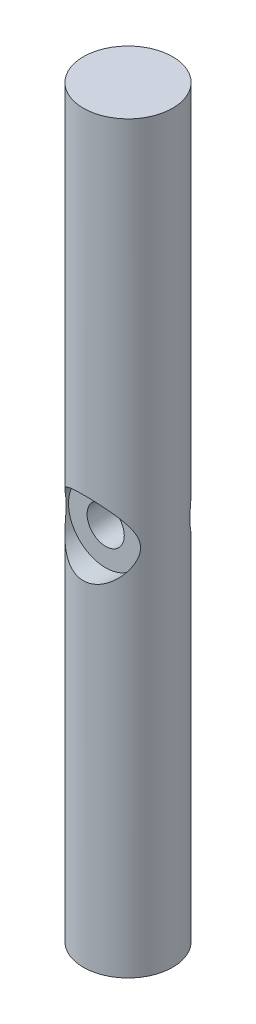
from build123d import *

# Parameters (mm, degrees)
SKETCH1_W           = 12
SKETCH1_H           = 12
BOSS_EXTRUDE1_DEPTH = 100
CUT_EXTRUDE1_REACH  = 103.43
SKETCH5_R           = 2.5
SKETCH6_R           = 5
CUT_EXTRUDE3_DEPTH  = 3
CUT_EXTRUDE4_START  = -3
SKETCH7_R           = 5
SKETCH7_R_2         = 2.5
CUT_EXTRUDE4_DEPTH  = 3
CUT_EXTRUDE5_DEPTH  = 100


with BuildPart() as part:
    # Sketch1 → Boss-Extrude1 (new body)
    with BuildSketch(Plane(origin=(0, 0, 0), x_dir=(1, 0, 0), z_dir=(0, 1, 0))):
        with Locations((6, -6)):
            Rectangle(SKETCH1_W, SKETCH1_H)
    extrude(amount=BOSS_EXTRUDE1_DEPTH)

    # Sketch5 → Cut-Extrude1 (cut, up to next)
    with BuildSketch(Plane.XY.offset(12), mode=Mode.PRIVATE) as cut_extrude1_sk1:
        with Locations((6, 50)):
            Circle(SKETCH5_R)
    cut_extrude1_tool1 = extrude(cut_extrude1_sk1.sketch, amount=-CUT_EXTRUDE1_REACH, mode=Mode.PRIVATE) & part.part
    add(cut_extrude1_tool1.solids().sort_by_distance((6, 50, 12))[0], mode=Mode.SUBTRACT)

    # Sketch6 → Cut-Extrude3 (cut)
    with BuildSketch(Plane.XY.offset(12)):
        with Locations((6, 50)):
            Circle(SKETCH6_R)
    extrude(amount=-CUT_EXTRUDE3_DEPTH, mode=Mode.SUBTRACT)

    # Sketch7 → Cut-Extrude4 (cut)
    with BuildSketch(Plane(origin=(0, 0, 0), x_dir=(-1, 0, 0), z_dir=(0, 0, -1)).offset(CUT_EXTRUDE4_START)):
        with Locations(Location((-6, 50, 0), (0, 0, 180))):
            Circle(SKETCH7_R)
        with Locations(Location((-6, 50, 0), (0, 0, 180))):
            Circle(SKETCH7_R_2, mode=Mode.SUBTRACT)
    extrude(amount=CUT_EXTRUDE4_DEPTH, mode=Mode.SUBTRACT)

    # Sketch8 → Cut-Extrude5 (cut)
    with BuildSketch(Plane(origin=(0, 100, 0), x_dir=(1, 0, 0), z_dir=(0, 1, 0))):
        with BuildLine():
            Line((0, -12), (6, -12))
            ThreePointArc((6, -12), (1.757359303, -10.242640677), (0, -5.999999971))
            Line((0, -5.999999971), (0, -12))
        make_face()
        with BuildLine():
            Line((12, -12), (12, -6))
            ThreePointArc((12, -6), (10.242640687, -10.242640687), (6, -12))
            Line((6, -12), (12, -12))
        make_face()
        with BuildLine():
            ThreePointArc((5.999999987, 0), (10.242640683, -1.757359308), (12, -6))
            Line((12, -6), (12, 0))
            Line((12, 0), (5.999999987, 0))
        make_face()
        with BuildLine():
            ThreePointArc((0, -5.999999971), (1.757359319, -1.757359307), (5.999999987, 0))
            Line((5.999999987, 0), (0, 0))
            Line((0, 0), (0, -5.999999971))
        make_face()
    extrude(amount=-CUT_EXTRUDE5_DEPTH, mode=Mode.SUBTRACT)


solid = part.part
